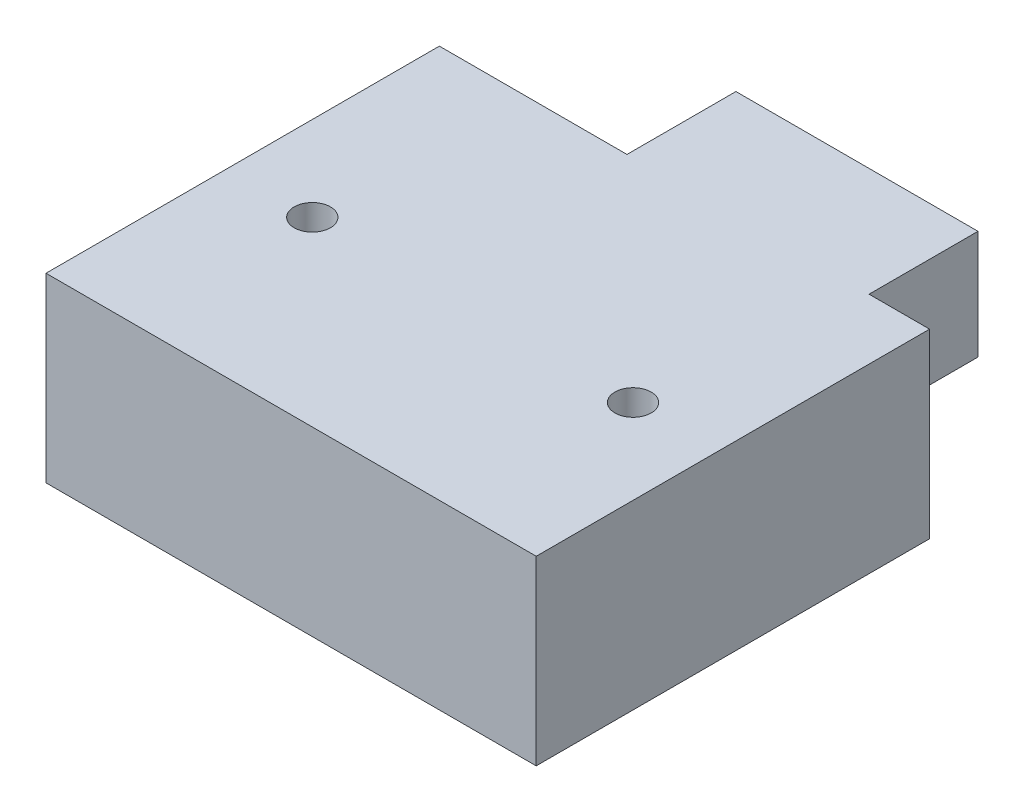
from build123d import *

# Parameters (mm, degrees)
SKETCH1_W           = 40.5
SKETCH1_H           = 32.5
SKETCH1_R           = 1.5
BOSS_EXTRUDE1_DEPTH = 15
SKETCH3_W           = 20
SKETCH3_H           = 9
BOSS_EXTRUDE2_DEPTH = 9


with BuildPart() as part:
    # Sketch1 → Boss-Extrude1 (new body)
    with BuildSketch(Plane(origin=(0, 0, 0), x_dir=(1, 0, 0), z_dir=(0, 1, 0))):
        Rectangle(SKETCH1_W, SKETCH1_H)
        with Locations(Location((-13.25, -1.25, 0), (0, 0, 270))):
            Circle(SKETCH1_R, mode=Mode.SUBTRACT)
        with Locations(Location((13.25, -1.25, 0), (0, 0, 270))):
            Circle(SKETCH1_R, mode=Mode.SUBTRACT)
    extrude(amount=BOSS_EXTRUDE1_DEPTH)

    # Sketch3 → Boss-Extrude2 (add)
    with BuildSketch(Plane(origin=(0, 0, -16.25), x_dir=(-1, 0, 0), z_dir=(0, 0, -1))):
        with Locations((-5.25, 10.5)):
            Rectangle(SKETCH3_W, SKETCH3_H)
    extrude(amount=BOSS_EXTRUDE2_DEPTH)


solid = part.part
